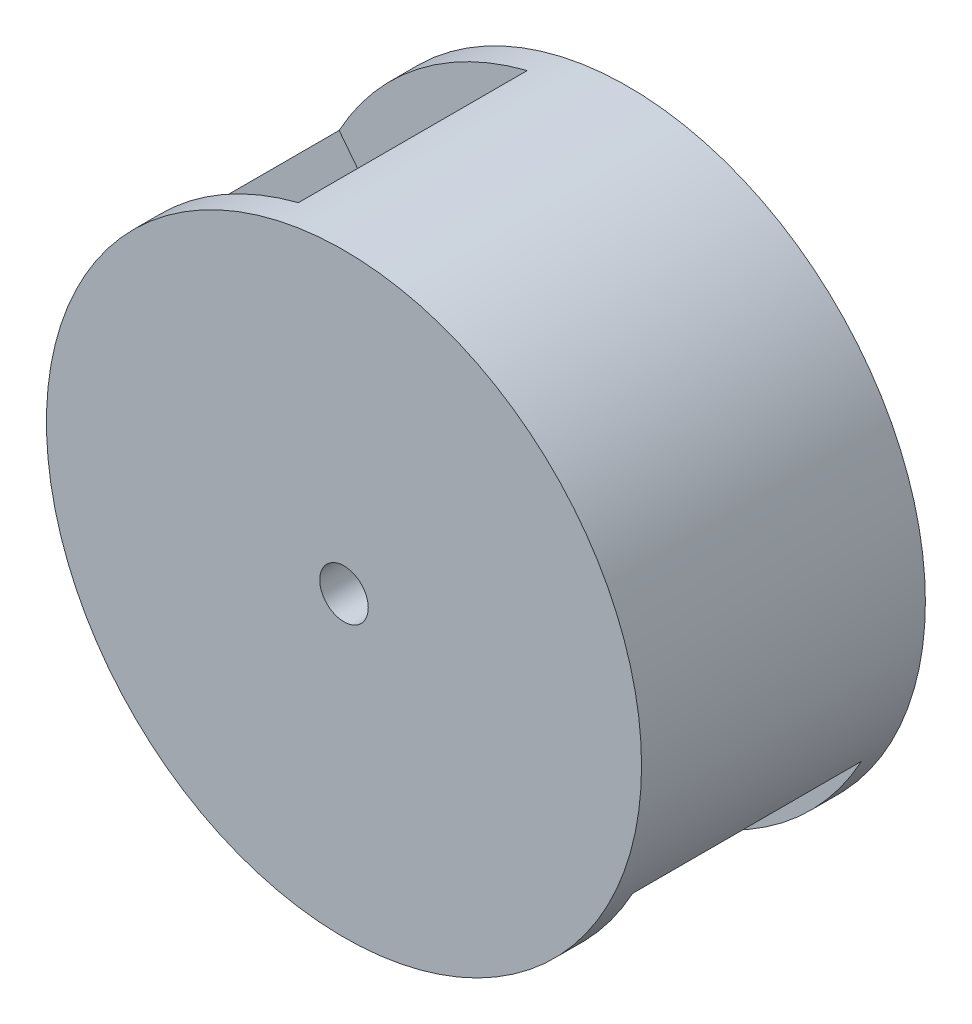
from build123d import *

# Parameters (mm, degrees)
SKETCH2_R           = 32.5
BOSS_EXTRUDE1_DEPTH = 3
BOSS_EXTRUDE2_DEPTH = 25
SKETCH4_R           = 32.5
BOSS_EXTRUDE3_DEPTH = 3
CUT_EXTRUDE1_DEPTH  = 56.439155838
SKETCH7_R           = 2.65
CUT_EXTRUDE2_DEPTH  = 3


with BuildPart() as part:
    # Sketch2 → Boss-Extrude1 (new body)
    with BuildSketch(Plane.XY):
        Circle(SKETCH2_R)
    extrude(amount=BOSS_EXTRUDE1_DEPTH)

    # Sketch3 → Boss-Extrude2 (add)
    with BuildSketch(Plane.XY.offset(3)):
        with BuildLine():
            Line((0, 7.5), (0, 21.210393848))
            Line((0, 21.210393848), (-7.984489127, 31.503935205))
            ThreePointArc((-7.984489127, 31.503935205), (-4.023189397, 32.250022435), (0, 32.5))
            ThreePointArc((0, 32.5), (25.680037902, 19.919479244), (31.478952737, -8.082421333))
            ThreePointArc((31.478952737, -8.082421333), (30.23630216, -11.917047944), (28.528519449, -15.56835181))
            Line((28.528519449, -15.56835181), (20.544030322, -5.274810453))
            Line((20.544030322, -5.274810453), (7.264373708, -1.865174154))
            ThreePointArc((7.264373708, -1.865174154), (4.596802902, -5.926162593), (0, -7.5))
            Line((0, -7.5), (0, -21.210393848))
            Line((0, -21.210393848), (7.984489127, -31.503935205))
            ThreePointArc((7.984489127, -31.503935205), (4.023189397, -32.250022435), (0, -32.5))
            ThreePointArc((0, -32.5), (-25.680037902, -19.919479244), (-31.478952737, 8.082421333))
            ThreePointArc((-31.478952737, 8.082421333), (-30.23630216, 11.917047944), (-28.528519449, 15.56835181))
            Line((-28.528519449, 15.56835181), (-20.544030322, 5.274810453))
            Line((-20.544030322, 5.274810453), (-7.264373708, 1.865174154))
            ThreePointArc((-7.264373708, 1.865174154), (-4.596802902, 5.926162593), (0, 7.5))
        make_face()
    extrude(amount=BOSS_EXTRUDE2_DEPTH)

    # Sketch4 → Boss-Extrude3 (add)
    with BuildSketch(Plane.XY.offset(28)):
        Circle(SKETCH4_R)
    extrude(amount=BOSS_EXTRUDE3_DEPTH)

    # Sketch5 → Cut-Extrude1 (cut, through all)
    with BuildSketch(Plane.XY.offset(31)):
        with BuildLine():
            Line((-1.549193338, 2.15), (1.549193338, 2.15))
            ThreePointArc((1.549193338, 2.15), (0, -2.65), (-1.549193338, 2.15))
        make_face()
    extrude(amount=-CUT_EXTRUDE1_DEPTH, mode=Mode.SUBTRACT)

    # Sketch7 → Cut-Extrude2 (cut)
    with BuildSketch(Plane.XY.offset(31)):
        Circle(SKETCH7_R)
    extrude(amount=-CUT_EXTRUDE2_DEPTH, mode=Mode.SUBTRACT)


solid = part.part
